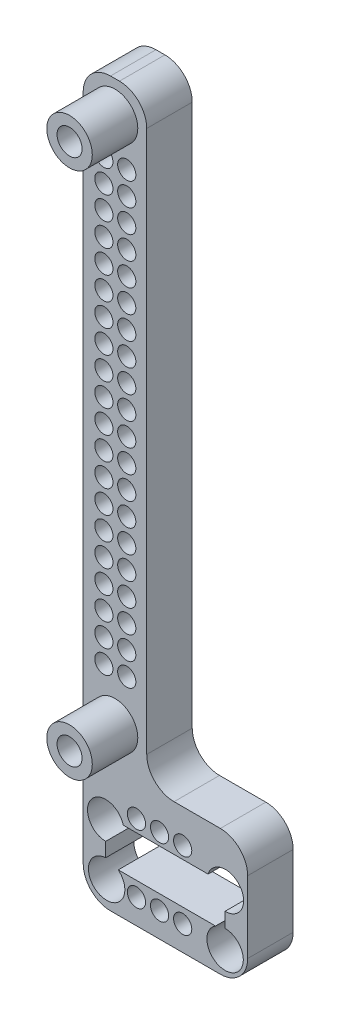
from build123d import *

# Parameters (mm, degrees)
SKETCH2_R       = 2.5
SKETCH2_R_2     = 1
MAIN_BODY_DEPTH = 5
FILLET1_R       = 3
SKETCH2_3_R     = 2.5
SKETCH2_3_R_2   = 1.375
STRAWS_DEPTH    = 10


with BuildPart() as part:
    # Sketch2 → Main Body (new body)
    with BuildSketch(Plane.XY):
        Polygon((141.081115161, -34.767752), (134.096872, -34.767752), (134.096872, -114.226250672), (152.171772965, -114.226250672), (152.171772965, -100.344538887), (141.081115161, -100.344538887), align=None)
        with Locations((137.596872, -96.267752)):
            Circle(SKETCH2_R, mode=Mode.SUBTRACT)
        with Locations((136.368346882, -91.088967224)):
            Circle(SKETCH2_R_2, mode=Mode.SUBTRACT)
        with Locations((136.368346882, -88.548967224)):
            Circle(SKETCH2_R_2, mode=Mode.SUBTRACT)
        with Locations((136.368346882, -86.008967224)):
            Circle(SKETCH2_R_2, mode=Mode.SUBTRACT)
        with Locations((136.368346882, -83.468967224)):
            Circle(SKETCH2_R_2, mode=Mode.SUBTRACT)
        with Locations((136.368346882, -80.928967224)):
            Circle(SKETCH2_R_2, mode=Mode.SUBTRACT)
        with Locations((136.368346882, -78.388967224)):
            Circle(SKETCH2_R_2, mode=Mode.SUBTRACT)
        with Locations((136.368346882, -75.848967224)):
            Circle(SKETCH2_R_2, mode=Mode.SUBTRACT)
        with Locations((138.883114052, -91.04875221)):
            Circle(SKETCH2_R_2, mode=Mode.SUBTRACT)
        with Locations((138.883114052, -88.50875221)):
            Circle(SKETCH2_R_2, mode=Mode.SUBTRACT)
        with Locations((138.883114052, -85.96875221)):
            Circle(SKETCH2_R_2, mode=Mode.SUBTRACT)
        with Locations((138.883114052, -83.42875221)):
            Circle(SKETCH2_R_2, mode=Mode.SUBTRACT)
        with Locations((138.883114052, -80.88875221)):
            Circle(SKETCH2_R_2, mode=Mode.SUBTRACT)
        with Locations((138.883114052, -78.34875221)):
            Circle(SKETCH2_R_2, mode=Mode.SUBTRACT)
        with Locations((138.883114052, -75.80875221)):
            Circle(SKETCH2_R_2, mode=Mode.SUBTRACT)
        with Locations((136.368346882, -73.308967224)):
            Circle(SKETCH2_R_2, mode=Mode.SUBTRACT)
        with Locations((136.368346882, -70.768967224)):
            Circle(SKETCH2_R_2, mode=Mode.SUBTRACT)
        with Locations((136.368346882, -68.228967224)):
            Circle(SKETCH2_R_2, mode=Mode.SUBTRACT)
        with Locations((136.368346882, -65.688967224)):
            Circle(SKETCH2_R_2, mode=Mode.SUBTRACT)
        with Locations((136.368346882, -63.148967224)):
            Circle(SKETCH2_R_2, mode=Mode.SUBTRACT)
        with Locations((136.368346882, -60.608967224)):
            Circle(SKETCH2_R_2, mode=Mode.SUBTRACT)
        with Locations((136.368346882, -58.068967224)):
            Circle(SKETCH2_R_2, mode=Mode.SUBTRACT)
        with Locations((136.368346882, -55.528967224)):
            Circle(SKETCH2_R_2, mode=Mode.SUBTRACT)
        with Locations((138.883114052, -73.26875221)):
            Circle(SKETCH2_R_2, mode=Mode.SUBTRACT)
        with Locations((138.883114052, -70.72875221)):
            Circle(SKETCH2_R_2, mode=Mode.SUBTRACT)
        with Locations((138.883114052, -68.18875221)):
            Circle(SKETCH2_R_2, mode=Mode.SUBTRACT)
        with Locations((138.883114052, -65.64875221)):
            Circle(SKETCH2_R_2, mode=Mode.SUBTRACT)
        with Locations((138.883114052, -63.10875221)):
            Circle(SKETCH2_R_2, mode=Mode.SUBTRACT)
        with Locations((138.883114052, -60.56875221)):
            Circle(SKETCH2_R_2, mode=Mode.SUBTRACT)
        with Locations((138.883114052, -58.02875221)):
            Circle(SKETCH2_R_2, mode=Mode.SUBTRACT)
        with Locations((138.883114052, -55.48875221)):
            Circle(SKETCH2_R_2, mode=Mode.SUBTRACT)
        with Locations((136.368346882, -52.988967224)):
            Circle(SKETCH2_R_2, mode=Mode.SUBTRACT)
        with Locations((136.368346882, -50.448967224)):
            Circle(SKETCH2_R_2, mode=Mode.SUBTRACT)
        with Locations((136.368346882, -47.908967224)):
            Circle(SKETCH2_R_2, mode=Mode.SUBTRACT)
        with Locations((136.368346882, -45.368967224)):
            Circle(SKETCH2_R_2, mode=Mode.SUBTRACT)
        with Locations((136.368346882, -42.828967224)):
            Circle(SKETCH2_R_2, mode=Mode.SUBTRACT)
        with Locations((137.596872, -38.267752)):
            Circle(SKETCH2_R, mode=Mode.SUBTRACT)
        with Locations((138.883114052, -52.94875221)):
            Circle(SKETCH2_R_2, mode=Mode.SUBTRACT)
        with Locations((138.883114052, -50.40875221)):
            Circle(SKETCH2_R_2, mode=Mode.SUBTRACT)
        with Locations((138.883114052, -47.86875221)):
            Circle(SKETCH2_R_2, mode=Mode.SUBTRACT)
        with Locations((138.883114052, -45.32875221)):
            Circle(SKETCH2_R_2, mode=Mode.SUBTRACT)
        with Locations((138.883114052, -42.78875221)):
            Circle(SKETCH2_R_2, mode=Mode.SUBTRACT)
        with BuildLine():
            Line((138.496220073, -105.367628272), (147.819131421, -105.367628272))
            ThreePointArc((147.819131421, -105.367628272), (151.349843906, -104.796920677), (149.692119851, -107.966082833))
            Line((149.692119851, -107.966082833), (149.692119851, -109.599156243))
            ThreePointArc((149.692119851, -109.599156243), (150.237287523, -113.523420313), (148.643073288, -109.896364034))
            Line((148.643073288, -109.896364034), (137.950744717, -109.896364034))
            ThreePointArc((137.950744717, -109.896364034), (136.043263655, -113.333173494), (136.567489161, -109.437620787))
            Line((136.567489161, -109.437620787), (136.567489161, -107.874618377))
            ThreePointArc((136.567489161, -107.874618377), (134.985954912, -104.66245765), (138.496220073, -105.367628272))
        make_face(mode=Mode.SUBTRACT)
        with Locations((145.030003125, -104.034694376)):
            Circle(SKETCH2_R_2, mode=Mode.SUBTRACT)
        with Locations((139.950003125, -111.497761483)):
            Circle(SKETCH2_R_2, mode=Mode.SUBTRACT)
        with Locations((142.490003125, -111.497761483)):
            Circle(SKETCH2_R_2, mode=Mode.SUBTRACT)
        with Locations((139.950003125, -104.034694376)):
            Circle(SKETCH2_R_2, mode=Mode.SUBTRACT)
        with Locations((142.490003125, -104.034694376)):
            Circle(SKETCH2_R_2, mode=Mode.SUBTRACT)
        with Locations((145.030003125, -111.497761483)):
            Circle(SKETCH2_R_2, mode=Mode.SUBTRACT)
    extrude(amount=MAIN_BODY_DEPTH)

    # Fillet1
    fillet1_edges = [part.edges().sort_by_distance(p)[0] for p in [
        (141.081115161, -100.344538887, 2.5),
        (152.171772965, -100.344538887, 2.5),
        (152.171772965, -114.226250672, 2.5),
        (134.096872, -114.226250672, 2.5),
        (141.081115161, -34.767752, 2.5),
        (134.096872, -34.767752, 2.5),
    ]]
    fillet(fillet1_edges, radius=FILLET1_R)

    # Sketch2<3> → Straws (add)
    # profile 1 of 2: a face of its own
    with BuildSketch(Plane.XY):
        with Locations((137.596872, -38.267752)):
            Circle(SKETCH2_3_R)
        with Locations((137.596872, -38.267752)):
            Circle(SKETCH2_3_R_2, mode=Mode.SUBTRACT)
    # profile 2 of 2: a face of its own
    with BuildSketch(Plane.XY):
        with Locations((137.596872, -96.267752)):
            Circle(SKETCH2_3_R)
        with Locations((137.596872, -96.267752)):
            Circle(SKETCH2_3_R_2, mode=Mode.SUBTRACT)
    extrude(amount=STRAWS_DEPTH)


solid = part.part
